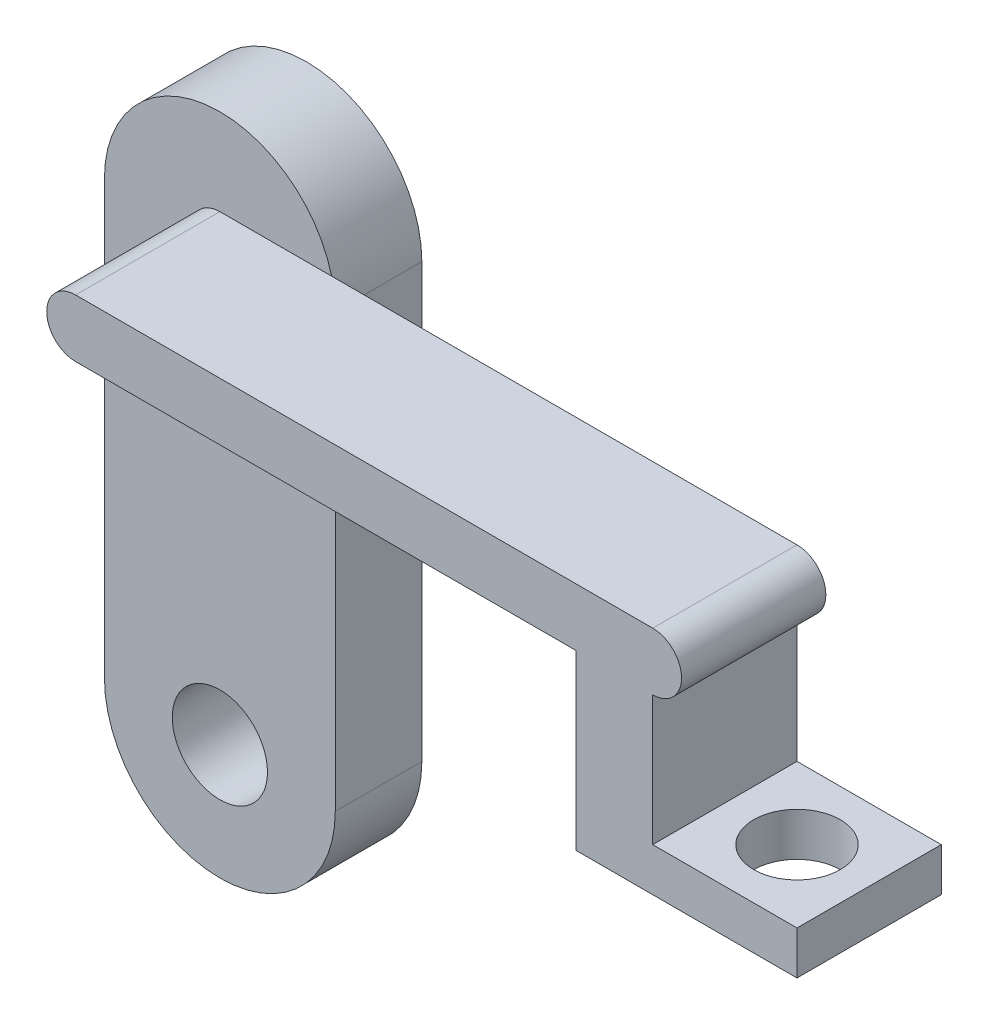
from build123d import *

# Parameters (mm, degrees)
SKETCH3_R           = 1.65
BOSS_EXTRUDE1_DEPTH = 3
BOSS_EXTRUDE2_DEPTH = 5
SKETCH11_W          = 2.655817679
SKETCH11_H          = 5
BOSS_EXTRUDE6_DEPTH = 6
SKETCH12_W          = 5
SKETCH12_H          = 1.502128234
BOSS_EXTRUDE7_DEPTH = 5
SKETCH13_R          = 1.5
CUT_EXTRUDE3_DEPTH  = 5


with BuildPart() as part:
    # Sketch3 → Boss-Extrude1 (new body)
    with BuildSketch(Plane.XY):
        with BuildLine():
            Line((-4, 0), (-4, 15))
            ThreePointArc((-4, 15), (0, 19), (4, 15))
            Line((4, 15), (4, 0))
            ThreePointArc((4, 0), (0, -4), (-4, 0))
        make_face()
        Circle(SKETCH3_R, mode=Mode.SUBTRACT)
    extrude(amount=BOSS_EXTRUDE1_DEPTH)

    # Sketch4 → Boss-Extrude2 (add)
    with BuildSketch(Plane.XY.offset(3)):
        with BuildLine():
            Line((0, 16), (20, 16))
            ThreePointArc((20, 16), (21, 15), (20, 14))
            Line((20, 14), (0, 14))
            ThreePointArc((0, 14), (-1, 15), (0, 16))
        make_face()
    extrude(amount=BOSS_EXTRUDE2_DEPTH)

    # Sketch11 → Boss-Extrude6 (add)
    with BuildSketch(Plane.XZ.offset(-14)):
        with Locations((18.672091161, 5.5)):
            Rectangle(SKETCH11_W, SKETCH11_H)
    extrude(amount=BOSS_EXTRUDE6_DEPTH)

    # Sketch12 → Boss-Extrude7 (add)
    with BuildSketch(Plane(origin=(20, 0, 0), x_dir=(0, 0, -1), z_dir=(1, 0, 0))):
        with Locations((-5.5, 8.751064117)):
            Rectangle(SKETCH12_W, SKETCH12_H)
    extrude(amount=BOSS_EXTRUDE7_DEPTH)

    # Sketch13 → Cut-Extrude3 (cut)
    with BuildSketch(Plane(origin=(0, 9.502128234, 0), x_dir=(1, 0, 0), z_dir=(0, 1, 0))):
        with Locations(Location((22.5, -5.5, 0), (0, 0, 270))):
            Circle(SKETCH13_R)
    extrude(amount=-CUT_EXTRUDE3_DEPTH, mode=Mode.SUBTRACT)


solid = part.part
